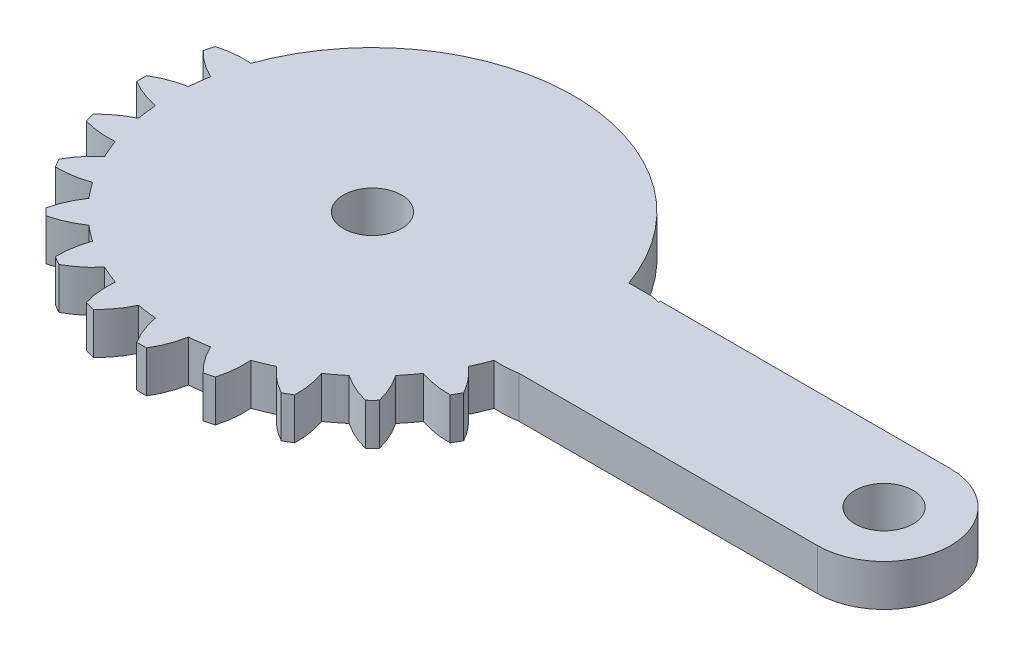
from build123d import *

# Parameters (mm, degrees)
SKETCH_1_R      = 7
EXTRUDE_2_DEPTH = 10


with BuildPart() as part:
    # 草图1 → 凸台-拉伸2 (new body)
    with BuildSketch(Plane(origin=(0, 0, 0), x_dir=(1, 0, 0), z_dir=(0, 1, 0))):
        with BuildLine():
            Line((51.235128203, 16), (45.636494169, 16))
            ThreePointArc((45.636494169, 16), (0.158881993, 48.359739004), (-45.530376716, 16.299521346))
            ThreePointArc((-45.530376716, 16.299521346), (-49.445367881, 16.258078448), (-53.288564328, 15.510606432))
            ThreePointArc((-53.288564328, 15.510606432), (-53.608883359, 14.364457003), (-53.904553655, 13.211702966))
            ThreePointArc((-53.904553655, 13.211702966), (-50.949983909, 10.642774988), (-47.580223553, 8.649388802))
            ThreePointArc((-47.580223553, 8.649388802), (-47.946273496, 6.312246656), (-48.197593301, 3.96))
            ThreePointArc((-48.197593301, 3.96), (-51.968458166, 2.906694959), (-55.487240876, 1.19))
            ThreePointArc((-55.487240876, 1.19), (-55.5, 0), (-55.487240876, -1.19))
            ThreePointArc((-55.487240876, -1.19), (-51.968458166, -2.906694959), (-48.197593301, -3.96))
            ThreePointArc((-48.197593301, -3.96), (-47.946273496, -6.312246656), (-47.580223553, -8.649388802))
            ThreePointArc((-47.580223553, -8.649388802), (-50.949983909, -10.642774988), (-53.904553655, -13.211702966))
            ThreePointArc((-53.904553655, -13.211702966), (-53.608883359, -14.364457003), (-53.288564328, -15.510606432))
            ThreePointArc((-53.288564328, -15.510606432), (-49.445367881, -16.258078448), (-45.530376716, -16.299521346))
            ThreePointArc((-45.530376716, -16.299521346), (-44.678814192, -18.506570789), (-43.7203402, -20.669336051))
            ThreePointArc((-43.7203402, -20.669336051), (-46.459352447, -23.466957407), (-48.648360184, -26.713050207))
            ThreePointArc((-48.648360184, -26.713050207), (-48.06440991, -27.75), (-47.458360184, -28.774190668))
            ThreePointArc((-47.458360184, -28.774190668), (-43.552657488, -28.501500759), (-39.7603402, -27.528257249))
            ThreePointArc((-39.7603402, -27.528257249), (-38.366567536, -29.439702707), (-36.880987913, -31.280702206))
            ThreePointArc((-36.880987913, -31.280702206), (-38.802592894, -34.691905461), (-40.076861362, -38.393947223))
            ThreePointArc((-40.076861362, -38.393947223), (-39.244426356, -39.244426356), (-38.393947223, -40.076861362))
            ThreePointArc((-38.393947223, -40.076861362), (-34.691905461, -38.802592894), (-31.280702206, -36.880987913))
            ThreePointArc((-31.280702206, -36.880987913), (-29.439702707, -38.366567536), (-27.528257249, -39.7603402))
            ThreePointArc((-27.528257249, -39.7603402), (-28.501500759, -43.552657488), (-28.774190668, -47.458360184))
            ThreePointArc((-28.774190668, -47.458360184), (-27.75, -48.06440991), (-26.713050207, -48.648360184))
            ThreePointArc((-26.713050207, -48.648360184), (-23.466957407, -46.459352447), (-20.669336051, -43.7203402))
            ThreePointArc((-20.669336051, -43.7203402), (-18.506570789, -44.678814192), (-16.299521346, -45.530376716))
            ThreePointArc((-16.299521346, -45.530376716), (-16.258078448, -49.445367881), (-15.510606432, -53.288564328))
            ThreePointArc((-15.510606432, -53.288564328), (-14.364457003, -53.608883359), (-13.211702966, -53.904553655))
            ThreePointArc((-13.211702966, -53.904553655), (-10.642774988, -50.949983909), (-8.649388802, -47.580223553))
            ThreePointArc((-8.649388802, -47.580223553), (-6.312246656, -47.946273496), (-3.96, -48.197593301))
            ThreePointArc((-3.96, -48.197593301), (-2.906694959, -51.968458166), (-1.19, -55.487240876))
            ThreePointArc((-1.19, -55.487240876), (0, -55.5), (1.19, -55.487240876))
            ThreePointArc((1.19, -55.487240876), (2.906694959, -51.968458166), (3.96, -48.197593301))
            ThreePointArc((3.96, -48.197593301), (6.312246656, -47.946273496), (8.649388802, -47.580223553))
            ThreePointArc((8.649388802, -47.580223553), (10.642774988, -50.949983909), (13.211702966, -53.904553655))
            ThreePointArc((13.211702966, -53.904553655), (14.364457003, -53.608883359), (15.510606432, -53.288564328))
            ThreePointArc((15.510606432, -53.288564328), (16.258078448, -49.445367881), (16.299521346, -45.530376716))
            ThreePointArc((16.299521346, -45.530376716), (18.506570789, -44.678814192), (20.669336051, -43.7203402))
            ThreePointArc((20.669336051, -43.7203402), (23.466957407, -46.459352447), (26.713050207, -48.648360184))
            ThreePointArc((26.713050207, -48.648360184), (27.75, -48.06440991), (28.774190668, -47.458360184))
            ThreePointArc((28.774190668, -47.458360184), (28.501500759, -43.552657488), (27.528257249, -39.7603402))
            ThreePointArc((27.528257249, -39.7603402), (29.439702707, -38.366567536), (31.280702206, -36.880987913))
            ThreePointArc((31.280702206, -36.880987913), (34.691905461, -38.802592894), (38.393947223, -40.076861362))
            ThreePointArc((38.393947223, -40.076861362), (39.244426356, -39.244426356), (40.076861362, -38.393947223))
            ThreePointArc((40.076861362, -38.393947223), (38.802592894, -34.691905461), (36.880987913, -31.280702206))
            ThreePointArc((36.880987913, -31.280702206), (38.366567536, -29.439702707), (39.7603402, -27.528257249))
            ThreePointArc((39.7603402, -27.528257249), (43.552657488, -28.501500759), (47.458360184, -28.774190668))
            ThreePointArc((47.458360184, -28.774190668), (48.06440991, -27.75), (48.648360184, -26.713050207))
            ThreePointArc((48.648360184, -26.713050207), (46.459352447, -23.466957407), (43.7203402, -20.669336051))
            ThreePointArc((43.7203402, -20.669336051), (44.678814192, -18.506570789), (45.530376716, -16.299521346))
            ThreePointArc((45.530376716, -16.299521346), (48.39269803, -16.339186258), (51.235128203, -16))
            Line((51.235128203, -16), (123, -16))
            ThreePointArc((123, -16), (139, 0), (123, 16))
            Line((123, 16), (53.143673189, 16))
            ThreePointArc((53.143673189, 16), (53.216681334, 15.755469774), (53.288564328, 15.510606432))
            ThreePointArc((53.288564328, 15.510606432), (52.267828339, 15.780403272), (51.235128203, 16))
        make_face()
        with Locations(Location((0, 0, 0), (0, 0, 270))):
            Circle(SKETCH_1_R, mode=Mode.SUBTRACT)
        with Locations(Location((123, 0, 0), (0, 0, 270))):
            Circle(SKETCH_1_R, mode=Mode.SUBTRACT)
    extrude(amount=EXTRUDE_2_DEPTH)


solid = part.part
